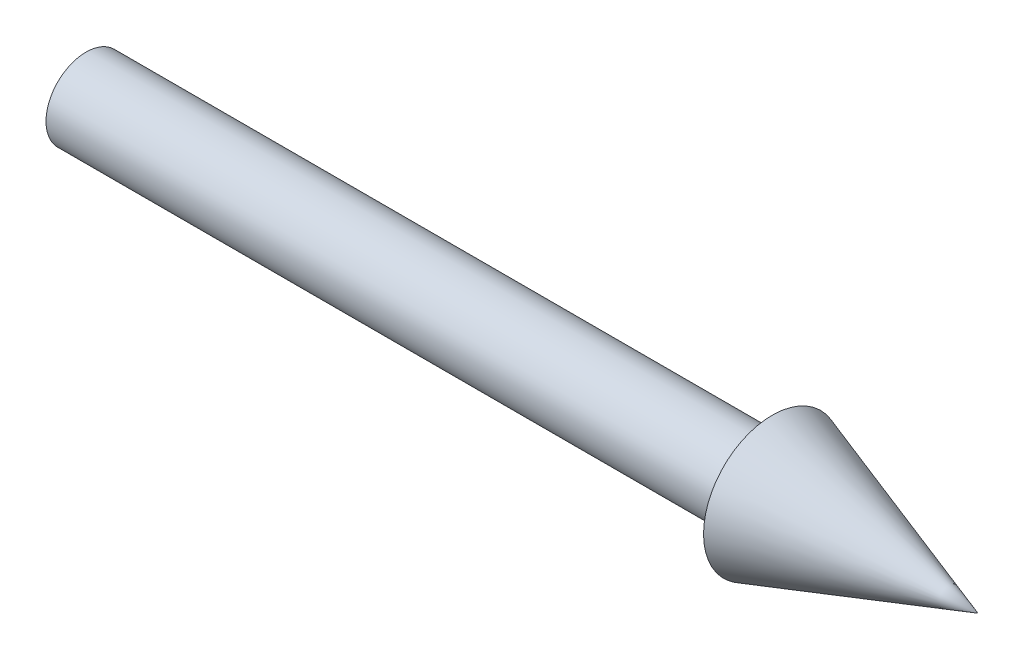
from build123d import *


with BuildPart() as part:
    # 草图1 → 旋转2 (revolve)
    with BuildSketch(Plane(origin=(0, 0, 0), x_dir=(1, 0, 0), z_dir=(0, 1, 0))):
        Polygon((60, -6), (78, 0), (50, 0), (0, 0), (0, -3.5), (60, -3.5), align=None)
    revolve(axis=Axis((0, 0, 0), (1, 0, 0)))


solid = part.part
